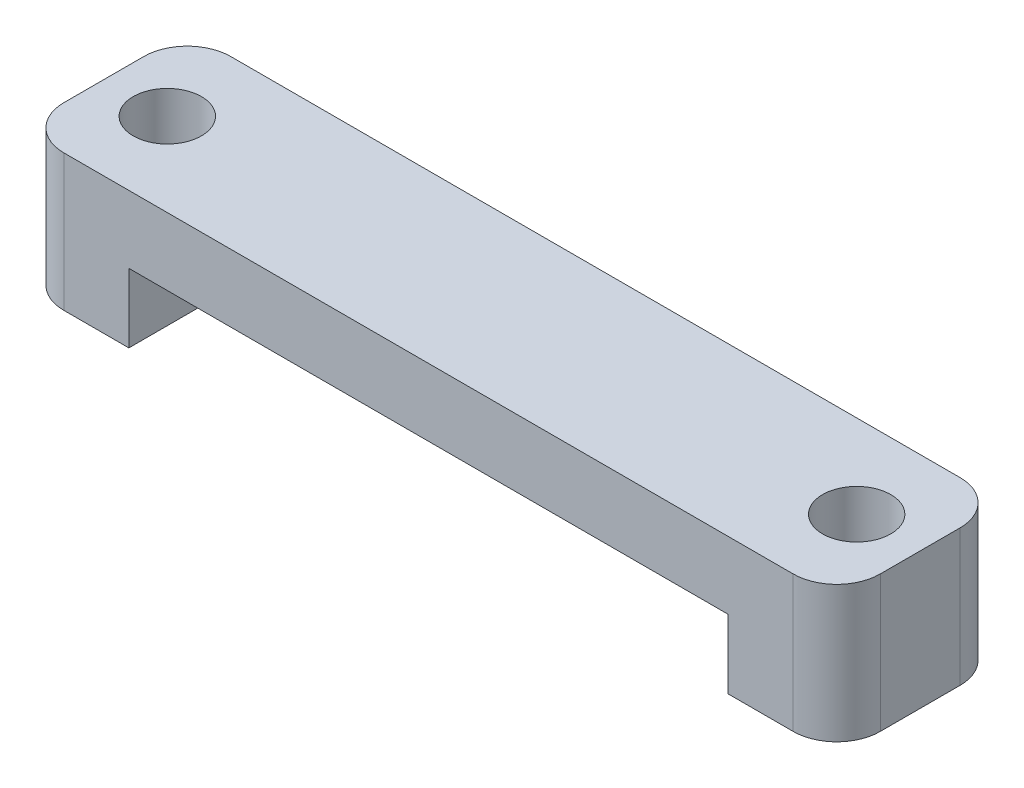
from build123d import *

# Parameters (mm, degrees)
SKETCH1_W               = 28.575
SKETCH1_H               = 5.842
SKETCH1_R               = 1.1938
BOSS_EXTRUDE1_DEPTH     = 4.7752
FILLET1_R               = 1.524
CUT_EXTRUDE2_DEPTH      = 16.344948103
CUT_EXTRUDE2_DEPTH_BACK = 16.344948103
SKETCH3_W               = 20.9804
SKETCH3_H               = 2.413


with BuildPart() as part:
    # Sketch1 → Boss-Extrude1 (new body)
    with BuildSketch(Plane(origin=(0, 0, 0), x_dir=(1, 0, 0), z_dir=(0, 1, 0))):
        Rectangle(SKETCH1_W, SKETCH1_H)
        with Locations(Location((12.065, 0, 0), (0, 0, 270))):
            Circle(SKETCH1_R, mode=Mode.SUBTRACT)
        with Locations(Location((-12.065, 0, 0), (0, 0, 270))):
            Circle(SKETCH1_R, mode=Mode.SUBTRACT)
    extrude(amount=BOSS_EXTRUDE1_DEPTH)

    # Fillet1
    fillet1_edges = [part.edges().sort_by_distance(p)[0] for p in [
        (-14.2875, 2.3876, -2.921),
        (14.2875, 2.3876, -2.921),
        (14.2875, 2.3876, 2.921),
        (-14.2875, 2.3876, 2.921),
    ]]
    fillet(fillet1_edges, radius=FILLET1_R)

    # Sketch3 → Cut-Extrude2 (cut, two sides: drawn at the far end of the back side and taken through both)
    with BuildSketch(Plane.XY.offset(-CUT_EXTRUDE2_DEPTH_BACK)):
        with Locations((0, 1.2065)):
            Rectangle(SKETCH3_W, SKETCH3_H)
    extrude(amount=CUT_EXTRUDE2_DEPTH + CUT_EXTRUDE2_DEPTH_BACK, mode=Mode.SUBTRACT)


solid = part.part
